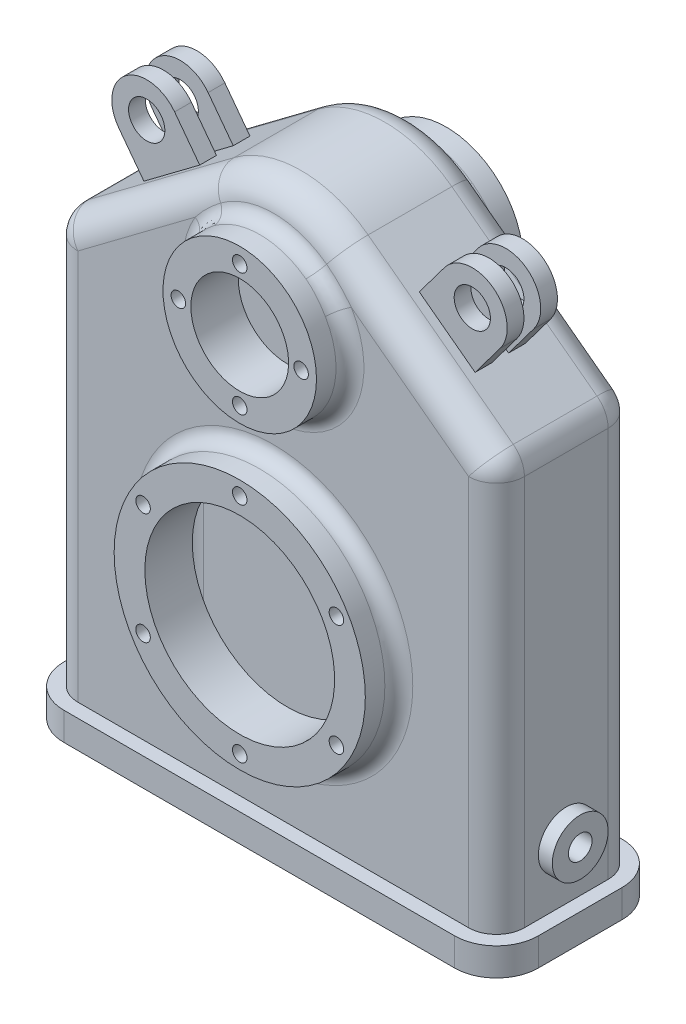
from build123d import *

# Parameters (mm, degrees)
BOSS_EXTRUDE1_DEPTH                        = 10
BOSS_EXTRUDE2_DEPTH                        = 25
FILLET1_R                                  = 10
CUT_EXTRUDE1_DEPTH                         = 20
SKETCH4_R                                  = 27.5
SKETCH4_R_2                                = 45
BOSS_EXTRUDE3_DEPTH                        = 12
BOSS_EXTRUDE4_START                        = 12
SKETCH9_R                                  = 45
SKETCH9_R_2                                = 27.5
BOSS_EXTRUDE4_DEPTH                        = 12
SKETCH10_R                                 = 17.5
SKETCH10_R_2                               = 34
CUT_EXTRUDE2_DEPTH                         = 277.407308226
FILLET2_R                                  = 5
FILLET3_R                                  = 5
FILLET4_R                                  = 5
FILLET5_R                                  = 5
SKETCH11_R                                 = 6.5
BOSS_EXTRUDE6_DEPTH                        = 6
BOSS_EXTRUDE7_START                        = -6
BOSS_EXTRUDE7_DEPTH                        = 6
SKETCH14_R                                 = 6.5
CUT_EXTRUDE3_DEPTH                         = 6
FILLET10_R                                 = 5
FILLET11_R                                 = 5
SKETCH15_R                                 = 10
BOSS_EXTRUDE8_DEPTH                        = 5
TAP_DRILL_FOR_M10_TAP1_D                   = 8.5
TAP_DRILL_FOR_M10_TAP1_DEPTH               = 47.446342369
TAP_DRILL_FOR_M10_TAP1_TIP                 = 2.553657631
TAP_DRILL_FOR_M5_HELICOIL1_D               = 5.2
TAP_DRILL_FOR_M5_HELICOIL1_DEPTH           = 8
TAP_DRILL_FOR_M5_HELICOIL1_TIP             = 1.562237609
TAP_DRILL_FOR_M5_HELICOIL1_ON_FACE_2_D     = 5.2
TAP_DRILL_FOR_M5_HELICOIL1_ON_FACE_2_DEPTH = 8
TAP_DRILL_FOR_M5_HELICOIL1_ON_FACE_2_TIP   = 1.562237609
TAP_DRILL_FOR_M5_HELICOIL1_ON_FACE_3_D     = 5.2
TAP_DRILL_FOR_M5_HELICOIL1_ON_FACE_3_DEPTH = 8
TAP_DRILL_FOR_M5_HELICOIL1_ON_FACE_3_TIP   = 1.562237609
TAP_DRILL_FOR_M5_HELICOIL2_D               = 5.2
TAP_DRILL_FOR_M5_HELICOIL2_DEPTH           = 6
TAP_DRILL_FOR_M5_HELICOIL2_TIP             = 1.562237609


with BuildPart() as part:
    # Sketch1 → Boss-Extrude1 (new body)
    with BuildSketch(Plane(origin=(0, 0, 0), x_dir=(1, 0, 0), z_dir=(0, 1, 0))):
        with BuildLine():
            Line((15, 0), (155, 0))
            ThreePointArc((155, 0), (165.606601718, 4.393398282), (170, 15))
            Line((170, 15), (170, 45))
            ThreePointArc((170, 45), (165.606601718, 55.606601718), (155, 60))
            Line((155, 60), (15, 60))
            ThreePointArc((15, 60), (4.393398282, 55.606601718), (0, 45))
            Line((0, 45), (0, 15))
            ThreePointArc((0, 15), (4.393398282, 4.393398282), (15, 0))
        make_face()
    extrude(amount=BOSS_EXTRUDE1_DEPTH)

    # Sketch2 → Boss-Extrude2 (add, symmetric)
    with BuildSketch(Plane.XY.offset(-30)):
        with BuildLine():
            Line((5, 10), (165, 10))
            Line((165, 10), (165, 150))
            ThreePointArc((165, 150), (163.94427191, 154.472135955), (161, 158))
            Line((161, 158), (109, 197))
            ThreePointArc((109, 197), (85, 205), (61, 197))
            Line((61, 197), (9, 158))
            ThreePointArc((9, 158), (6.05572809, 154.472135955), (5, 150))
            Line((5, 150), (5, 10))
        make_face()
    extrude(amount=BOSS_EXTRUDE2_DEPTH, both=True)

    # Fillet1
    fillet1_edges = [part.edges().sort_by_distance(p)[0] for p in [
        (5, 80, -55),
        (165, 80, -55),
        (163.94427191, 154.472135955, -55),
        (135, 177.5, -55),
        (85, 205, -55),
        (35, 177.5, -55),
        (6.05572809, 154.472135955, -55),
        (5, 80, -5),
        (165, 80, -5),
        (163.94427191, 154.472135955, -5),
        (135, 177.5, -5),
        (85, 205, -5),
        (35, 177.5, -5),
        (6.05572809, 154.472135955, -5),
    ]]
    fillet(fillet1_edges, radius=FILLET1_R)

    # Sketch3 → Cut-Extrude1 (cut, symmetric)
    with BuildSketch(Plane.XY.offset(-30)):
        with BuildLine():
            Line((10, 0), (10, 150))
            ThreePointArc((10, 150), (10.527864045, 152.236067977), (12, 154))
            Line((12, 154), (64, 193))
            ThreePointArc((64, 193), (85, 200), (106, 193))
            Line((106, 193), (158, 154))
            ThreePointArc((158, 154), (159.472135955, 152.236067977), (160, 150))
            Line((160, 150), (160, 0))
            Line((160, 0), (10, 0))
        make_face()
    extrude(amount=CUT_EXTRUDE1_DEPTH, both=True, mode=Mode.SUBTRACT)

    # Sketch4 → Boss-Extrude3 (add)
    with BuildSketch(Plane.XY.offset(-5)):
        with Locations((85, 165)):
            Circle(SKETCH4_R)
        with Locations((85, 75)):
            Circle(SKETCH4_R_2)
    extrude(amount=BOSS_EXTRUDE3_DEPTH)

    # Sketch9 → Boss-Extrude4 (add)
    with BuildSketch(Plane(origin=(0, 0, -55), x_dir=(-1, 0, 0), z_dir=(0, 0, -1)).offset(BOSS_EXTRUDE4_START)):
        with Locations(Location((-85, 75, 0), (0, 0, 180))):
            Circle(SKETCH9_R)
        with Locations(Location((-85, 165, 0), (0, 0, 180))):
            Circle(SKETCH9_R_2)
    extrude(amount=-BOSS_EXTRUDE4_DEPTH)

    # Sketch10 → Cut-Extrude2 (cut, through all)
    with BuildSketch(Plane(origin=(0, 0, -67), x_dir=(-1, 0, 0), z_dir=(0, 0, -1))):
        with Locations((-85, 165)):
            Circle(SKETCH10_R)
        with Locations((-85, 75)):
            Circle(SKETCH10_R_2)
    extrude(amount=-CUT_EXTRUDE2_DEPTH, mode=Mode.SUBTRACT)

    # Fillet2
    fillet2_edges = [part.edges().sort_by_distance(p)[0] for p in [
        (40, 75, -55),
    ]]
    fillet(fillet2_edges, radius=FILLET2_R)

    # Fillet3
    fillet3_edges = [part.edges().sort_by_distance(p)[0] for p in [
        (57.5, 165, -55),
        (85, 195, -55),
    ]]
    fillet(fillet3_edges, radius=FILLET3_R)

    # Fillet4
    fillet4_edges = [part.edges().sort_by_distance(p)[0] for p in [
        (57.5, 165, -5),
        (85, 195, -5),
    ]]
    fillet(fillet4_edges, radius=FILLET4_R)

    # Fillet5
    fillet5_edges = [part.edges().sort_by_distance(p)[0] for p in [
        (40, 75, -5),
    ]]
    fillet(fillet5_edges, radius=FILLET5_R)

    # Sketch11 → Boss-Extrude6 (add)
    # profile 1 of 2: a face of its own
    with BuildSketch(Plane(origin=(0, 0, -24), x_dir=(-1, 0, 0), z_dir=(0, 0, -1))):
        with BuildLine():
            Line((-153.333333333, 182.5), (-144.333333333, 170.5))
            Line((-144.333333333, 170.5), (-124.333333333, 185.5))
            Line((-124.333333333, 185.5), (-133.333333333, 197.5))
            ThreePointArc((-133.333333333, 197.5), (-150.833333333, 200), (-153.333333333, 182.5))
        make_face()
        with Locations((-143.333333333, 190)):
            Circle(SKETCH11_R, mode=Mode.SUBTRACT)
    # profile 2 of 2: a face of its own
    with BuildSketch(Plane(origin=(0, 0, -24), x_dir=(-1, 0, 0), z_dir=(0, 0, -1))):
        with BuildLine():
            Line((-36.666666667, 197.5), (-45.666666667, 185.5))
            Line((-45.666666667, 185.5), (-25.666666667, 170.5))
            Line((-25.666666667, 170.5), (-16.666666667, 182.5))
            ThreePointArc((-16.666666667, 182.5), (-19.166666667, 200), (-36.666666667, 197.5))
        make_face()
        with Locations((-26.666666667, 190)):
            Circle(SKETCH11_R, mode=Mode.SUBTRACT)
    extrude(amount=-BOSS_EXTRUDE6_DEPTH)

    # Sketch13 → Boss-Extrude7 (add)
    with BuildSketch(Plane.XY.offset(-30).offset(BOSS_EXTRUDE7_START)):
        with BuildLine():
            Line((133.333333333, 197.5), (124.333333333, 185.5))
            Line((124.333333333, 185.5), (144.333333333, 170.5))
            Line((144.333333333, 170.5), (153.333333333, 182.5))
            ThreePointArc((153.333333333, 182.5), (150.833333333, 200), (133.333333333, 197.5))
        make_face()
        with BuildLine():
            Line((16.666666667, 182.5), (25.666666667, 170.5))
            Line((25.666666667, 170.5), (45.666666667, 185.5))
            Line((45.666666667, 185.5), (36.666666667, 197.5))
            ThreePointArc((36.666666667, 197.5), (19.166666667, 200), (16.666666667, 182.5))
        make_face()
    extrude(amount=BOSS_EXTRUDE7_DEPTH)

    # Sketch14 → Cut-Extrude3 (cut)
    with BuildSketch(Plane(origin=(0, 0, -36), x_dir=(-1, 0, 0), z_dir=(0, 0, -1))):
        with Locations((-26.666666667, 190)):
            Circle(SKETCH14_R)
        with Locations((-143.333333333, 190)):
            Circle(SKETCH14_R)
    extrude(amount=-CUT_EXTRUDE3_DEPTH, mode=Mode.SUBTRACT)

    # Fillet10
    fillet10_edges = [part.edges().sort_by_distance(p)[0] for p in [
        (10, 75, -50),
        (10.527864045, 152.236067977, -50),
        (38, 173.5, -50),
        (85, 200, -50),
        (132, 173.5, -50),
        (159.472135955, 152.236067977, -50),
        (160, 75, -50),
    ]]
    fillet(fillet10_edges, radius=FILLET10_R)

    # Fillet11
    fillet11_edges = [part.edges().sort_by_distance(p)[0] for p in [
        (160, 75, -10),
        (159.472135955, 152.236067977, -10),
        (132, 173.5, -10),
        (85, 200, -10),
        (38, 173.5, -10),
        (10.527864045, 152.236067977, -10),
        (10, 75, -10),
    ]]
    fillet(fillet11_edges, radius=FILLET11_R)

    # Sketch15 → Boss-Extrude8 (add)
    with BuildSketch(Plane(origin=(165, 0, 0), x_dir=(0, 0, -1), z_dir=(1, 0, 0))):
        with Locations(Location((30, 30, 0), (0, 0, 180))):
            Circle(SKETCH15_R)
    extrude(amount=BOSS_EXTRUDE8_DEPTH)

    # Tap Drill for M10 Tap1
    with Locations(Plane(origin=(170, 30, -30), x_dir=(0, 0, 1), z_dir=(1, 0, 0))):
        with Locations((0, 0)):
            Hole(TAP_DRILL_FOR_M10_TAP1_D / 2, depth=TAP_DRILL_FOR_M10_TAP1_DEPTH)
            with Locations((0, 0, -(TAP_DRILL_FOR_M10_TAP1_DEPTH + TAP_DRILL_FOR_M10_TAP1_TIP / 2))):  # 118° drill point
                Cone(0, TAP_DRILL_FOR_M10_TAP1_D / 2, TAP_DRILL_FOR_M10_TAP1_TIP, mode=Mode.SUBTRACT)

    # Tap Drill for M5 Helicoil1
    with Locations(Plane(origin=(85, 187, 7), x_dir=(1, 0, 0), z_dir=(0, 0, 1))):
        with Locations((0, 0), (22, -22), (0, -72), (-34.641016151, -92), (-34.641016151, -132), (0, -152), (34.641016151, -132), (34.641016151, -92), (0, -44), (-22, -22)):
            Hole(TAP_DRILL_FOR_M5_HELICOIL1_D / 2, depth=TAP_DRILL_FOR_M5_HELICOIL1_DEPTH)
            with Locations((0, 0, -(TAP_DRILL_FOR_M5_HELICOIL1_DEPTH + TAP_DRILL_FOR_M5_HELICOIL1_TIP / 2))):  # 118° drill point
                Cone(0, TAP_DRILL_FOR_M5_HELICOIL1_D / 2, TAP_DRILL_FOR_M5_HELICOIL1_TIP, mode=Mode.SUBTRACT)

    # Tap Drill for M5 Helicoil1 on face 2
    with Locations(Plane(origin=(85, 143, -67), x_dir=(-1, 0, 0), z_dir=(0, 0, -1))):
        with Locations((0, 0), (22, 22), (0, -28), (-34.641016151, -48), (-34.641016151, -88), (0, -108), (34.641016151, -88), (34.641016151, -48), (-22, 22), (0, 44)):
            Hole(TAP_DRILL_FOR_M5_HELICOIL1_ON_FACE_2_D / 2, depth=TAP_DRILL_FOR_M5_HELICOIL1_ON_FACE_2_DEPTH)
            with Locations((0, 0, -(TAP_DRILL_FOR_M5_HELICOIL1_ON_FACE_2_DEPTH + TAP_DRILL_FOR_M5_HELICOIL1_ON_FACE_2_TIP / 2))):  # 118° drill point
                Cone(0, TAP_DRILL_FOR_M5_HELICOIL1_ON_FACE_2_D / 2, TAP_DRILL_FOR_M5_HELICOIL1_ON_FACE_2_TIP, mode=Mode.SUBTRACT)

    # Tap Drill for M5 Helicoil1 on face 3
    with Locations(Plane(origin=(-9.800047069, 169.569362429, 0), x_dir=(1, 0, 0), z_dir=(0, 0, 1))):
        with Locations((0, 0)):
            Hole(TAP_DRILL_FOR_M5_HELICOIL1_ON_FACE_3_D / 2, depth=TAP_DRILL_FOR_M5_HELICOIL1_ON_FACE_3_DEPTH)
            with Locations((0, 0, -(TAP_DRILL_FOR_M5_HELICOIL1_ON_FACE_3_DEPTH + TAP_DRILL_FOR_M5_HELICOIL1_ON_FACE_3_TIP / 2))):  # 118° drill point
                Cone(0, TAP_DRILL_FOR_M5_HELICOIL1_ON_FACE_3_D / 2, TAP_DRILL_FOR_M5_HELICOIL1_ON_FACE_3_TIP, mode=Mode.SUBTRACT)

    # Tap Drill for M5 Helicoil2
    with Locations(Plane(origin=(5, 0, -30), x_dir=(0, 0, -1), z_dir=(0, -1, 0))):
        with Locations((0, 0), (-25, 40), (25, 40), (25, 120), (0, 160), (-25, 120)):
            Hole(TAP_DRILL_FOR_M5_HELICOIL2_D / 2, depth=TAP_DRILL_FOR_M5_HELICOIL2_DEPTH)
            with Locations((0, 0, -(TAP_DRILL_FOR_M5_HELICOIL2_DEPTH + TAP_DRILL_FOR_M5_HELICOIL2_TIP / 2))):  # 118° drill point
                Cone(0, TAP_DRILL_FOR_M5_HELICOIL2_D / 2, TAP_DRILL_FOR_M5_HELICOIL2_TIP, mode=Mode.SUBTRACT)


solid = part.part
